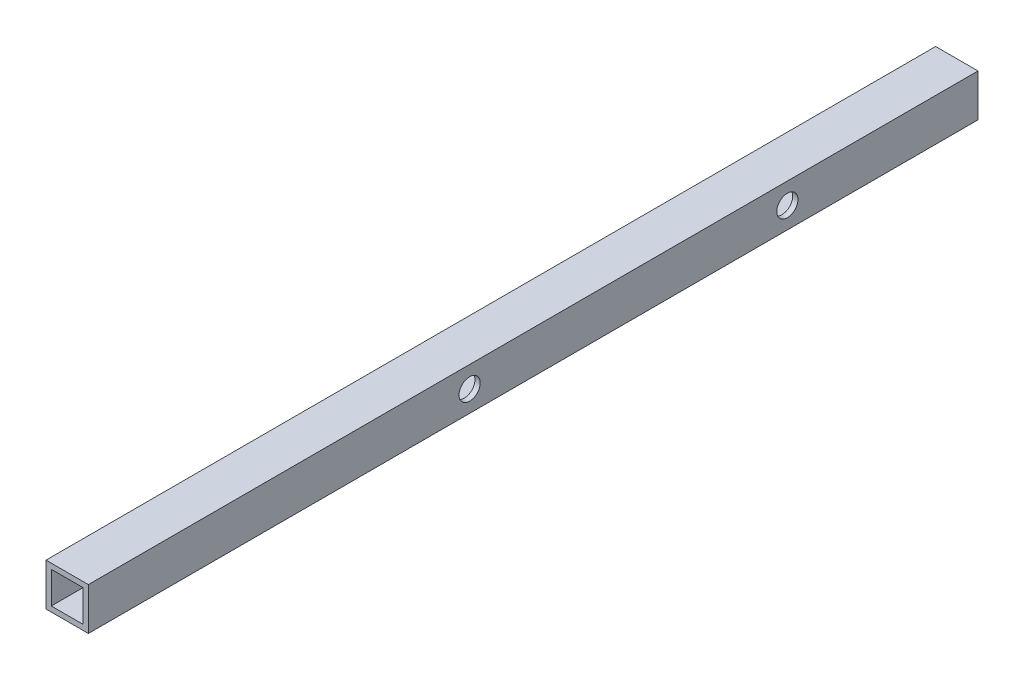
from build123d import *

# Parameters (mm, degrees)
SKETCH1_W           = 25.4
SKETCH1_H           = 25.4
SKETCH1_W_2         = 19.05
SKETCH1_H_2         = 19.05
EXTRUDE_THIN1_DEPTH = 533.4
SKETCH2_R           = 6.35
CUT_EXTRUDE1_DEPTH  = 535.155417458


with BuildPart() as part:
    # Sketch1 → Extrude-Thin1 (new body)
    with BuildSketch(Plane.XY):
        Rectangle(SKETCH1_W, SKETCH1_H)
        Rectangle(SKETCH1_W_2, SKETCH1_H_2, mode=Mode.SUBTRACT)
    extrude(amount=EXTRUDE_THIN1_DEPTH)

    # Sketch2 → Cut-Extrude1 (cut, through all)
    with BuildSketch(Plane(origin=(12.7, 0, 0), x_dir=(0, 0, -1), z_dir=(1, 0, 0))):
        with Locations((-304.8, 0)):
            Circle(SKETCH2_R)
        with Locations((-114.3, 0)):
            Circle(SKETCH2_R)
    extrude(amount=-CUT_EXTRUDE1_DEPTH, mode=Mode.SUBTRACT)


solid = part.part
